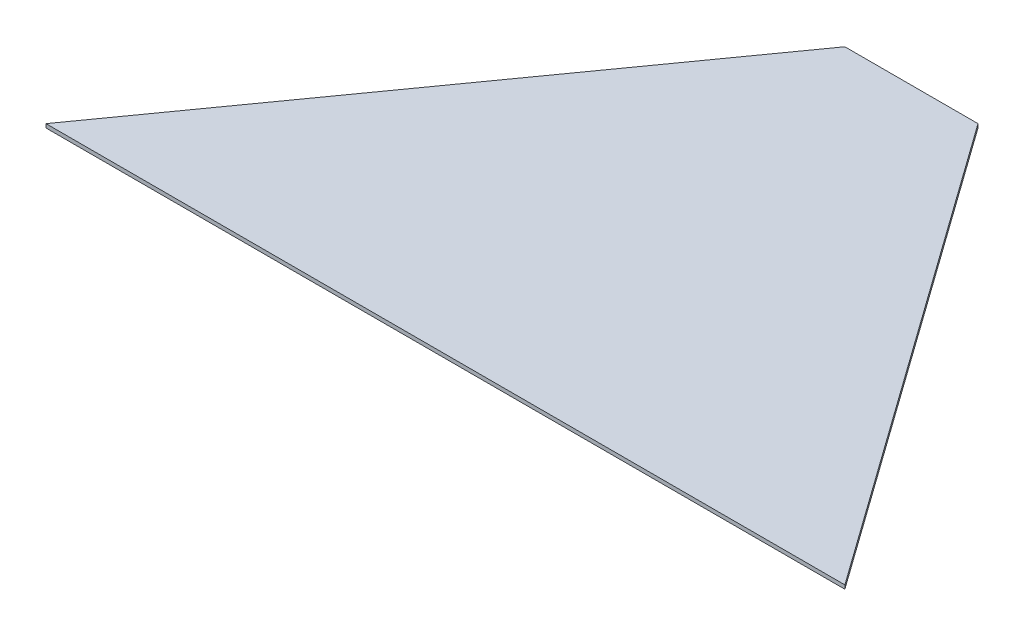
from build123d import *

# Parameters (mm, degrees)
BOSS_EXTRUDE1_DEPTH = 1


with BuildPart() as part:
    # Sketch1 → Boss-Extrude1 (new body)
    with BuildSketch(Plane(origin=(0, 0, 0), x_dir=(1, 0, 0), z_dir=(0, 1, 0))):
        Polygon((-17.5, 122.5), (17.5, 122.5), (105, 0), (-105, 0), align=None)
    extrude(amount=BOSS_EXTRUDE1_DEPTH)


solid = part.part
